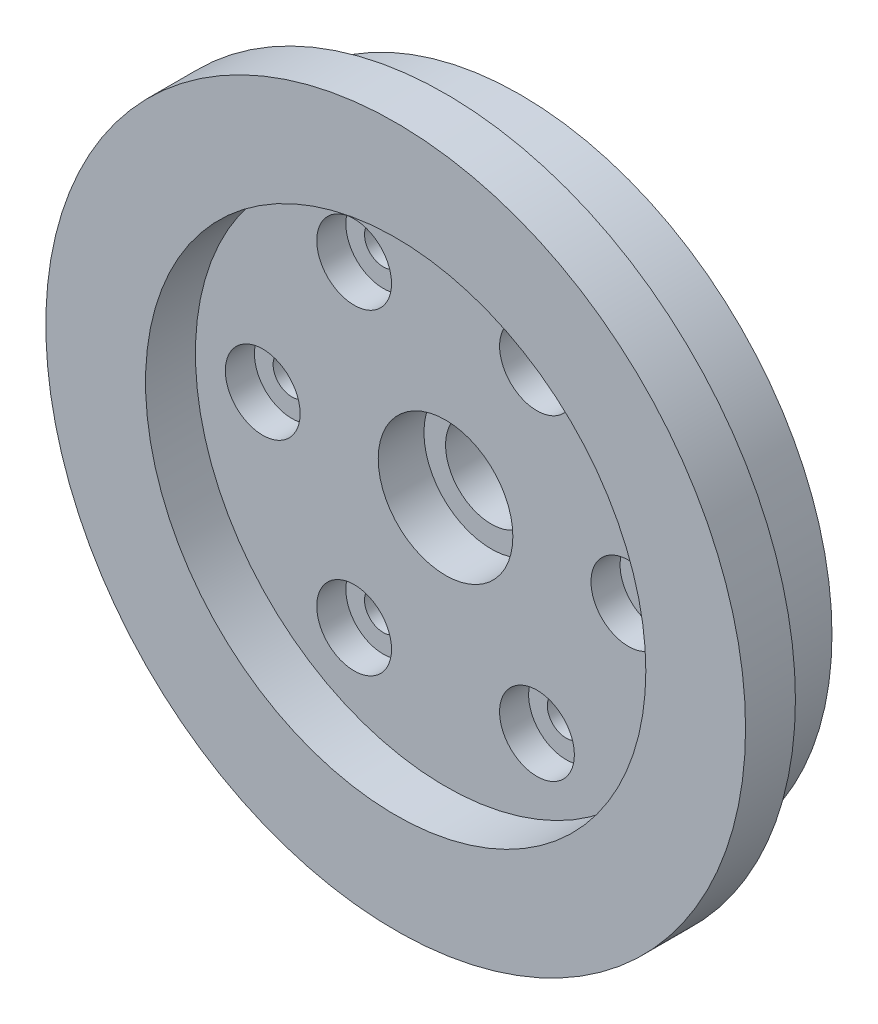
from build123d import *

# Parameters (mm, degrees)
ESQUISSE1_R             = 30.1
ESQUISSE1_R_2           = 2.25
ESQUISSE1_R_3           = 8.1
BOSS_EXTRU_1_DEPTH      = 10
ESQUISSE2_R             = 8.1
ESQUISSE2_R_2           = 5.5
BOSS_EXTRU_2_DEPTH      = 4.5
ESQUISSE3_R             = 4.5
ENL_V_MAT_EXTRU_1_DEPTH = 3.5
ESQUISSE4_R             = 42.1
ESQUISSE4_R_2           = 30.1
BOSS_EXTRU_3_DEPTH      = 6
BOSS_EXTRU_4_START      = 9
ESQUISSE6_R             = 37.5
ESQUISSE6_R_2           = 30.1
BOSS_EXTRU_4_DEPTH      = 9


with BuildPart() as part:
    # Esquisse1 → Boss.-Extru.1 (new body)
    with BuildSketch(Plane.XY):
        Circle(ESQUISSE1_R)
        with Locations((22, 0)):
            Circle(ESQUISSE1_R_2, mode=Mode.SUBTRACT)
        with Locations((11, -19.052558883)):
            Circle(ESQUISSE1_R_2, mode=Mode.SUBTRACT)
        with Locations((-11, -19.052558883)):
            Circle(ESQUISSE1_R_2, mode=Mode.SUBTRACT)
        with Locations((-22, 0)):
            Circle(ESQUISSE1_R_2, mode=Mode.SUBTRACT)
        with Locations((-11, 19.052558883)):
            Circle(ESQUISSE1_R_2, mode=Mode.SUBTRACT)
        with Locations((11, 19.052558883)):
            Circle(ESQUISSE1_R_2, mode=Mode.SUBTRACT)
        Circle(ESQUISSE1_R_3, mode=Mode.SUBTRACT)
    extrude(amount=BOSS_EXTRU_1_DEPTH)

    # Esquisse2 → Boss.-Extru.2 (add)
    with BuildSketch(Plane(origin=(0, 0, 0), x_dir=(-1, 0, 0), z_dir=(0, 0, -1))):
        Circle(ESQUISSE2_R)
        Circle(ESQUISSE2_R_2, mode=Mode.SUBTRACT)
    extrude(amount=-BOSS_EXTRU_2_DEPTH)

    # Esquisse3 → Enlèv. mat.-Extru.1 (cut)
    with BuildSketch(Plane.XY.offset(10)):
        with Locations((-11, 19.052558883)):
            Circle(ESQUISSE3_R)
        with Locations((11, 19.052558883)):
            Circle(ESQUISSE3_R)
        with Locations((22, 0)):
            Circle(ESQUISSE3_R)
        with Locations((11, -19.052558883)):
            Circle(ESQUISSE3_R)
        with Locations((-11, -19.052558883)):
            Circle(ESQUISSE3_R)
        with Locations((-22, 0)):
            Circle(ESQUISSE3_R)
    extrude(amount=-ENL_V_MAT_EXTRU_1_DEPTH, mode=Mode.SUBTRACT)



with BuildPart() as body_2:
    # Esquisse4 → Boss.-Extru.3 (new body)
    with BuildSketch(Plane.XY.offset(10)):
        Circle(ESQUISSE4_R)
        Circle(ESQUISSE4_R_2, mode=Mode.SUBTRACT)
    extrude(amount=BOSS_EXTRU_3_DEPTH)


with BuildPart() as part_1:
    add(part.part)

    add(body_2.part)  # Boss.-Extru.4 merges body 2
    # Esquisse6 → Boss.-Extru.4 (add)
    with BuildSketch(Plane(origin=(0, 0, 10), x_dir=(-1, 0, 0), z_dir=(0, 0, -1)).offset(BOSS_EXTRU_4_START)):
        Circle(ESQUISSE6_R)
        Circle(ESQUISSE6_R_2, mode=Mode.SUBTRACT)
    extrude(amount=-BOSS_EXTRU_4_DEPTH)


solid = part_1.part
